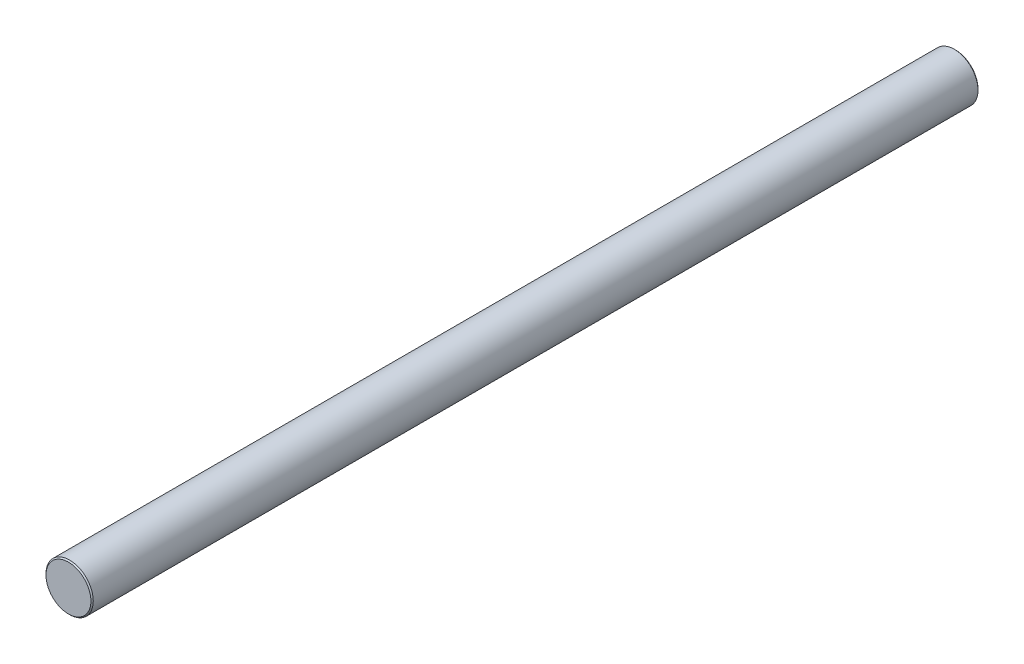
from build123d import *

# Parameters (mm, degrees)
SKETCH1_R           = 4
BOSS_EXTRUDE1_DEPTH = 150
CHAMFER1_SIZE       = 0.2


with BuildPart() as part:
    # Sketch1 → Boss-Extrude1 (new body)
    with BuildSketch(Plane.XY):
        Circle(SKETCH1_R)
    extrude(amount=BOSS_EXTRUDE1_DEPTH)

    # Chamfer1
    chamfer1_edges = [part.edges().sort_by_distance(p)[0] for p in [
        (-4, 0, 0),
        (-4, 0, 150),
    ]]
    chamfer(chamfer1_edges, length=CHAMFER1_SIZE)


solid = part.part
